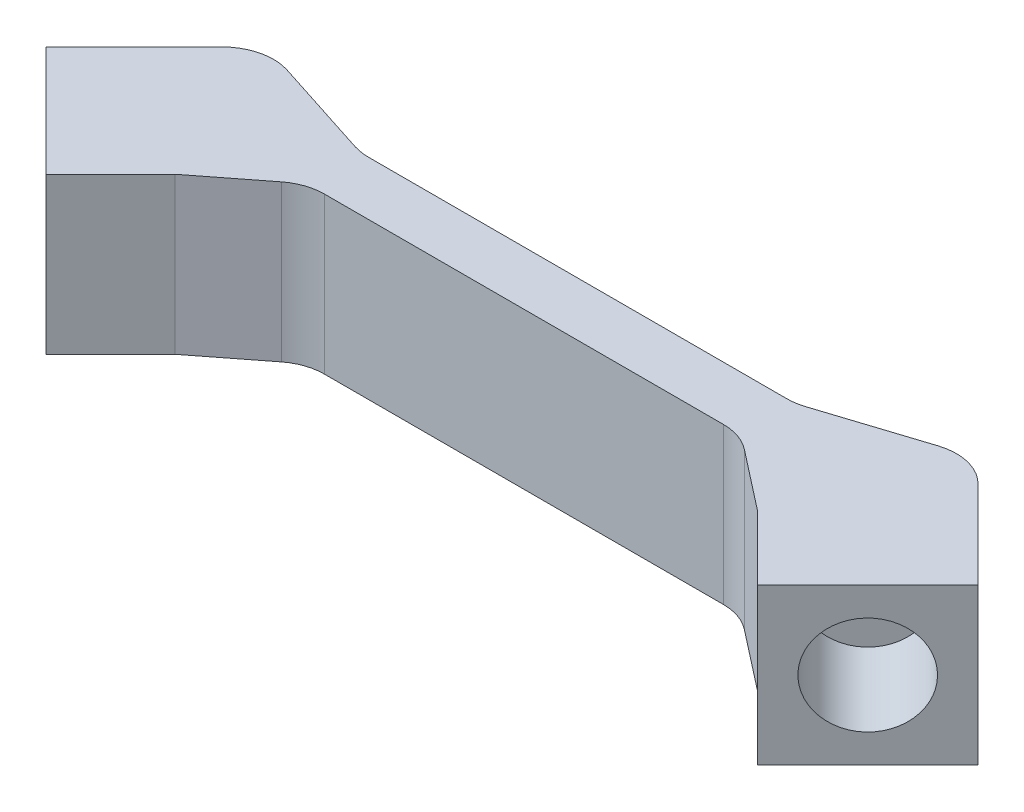
from build123d import *

# Parameters (mm, degrees)
BOSS_EXTRUDE1_DEPTH = 38.1
SKETCH2_R           = 12.065
CUT_EXTRUDE1_DEPTH  = 25.4
SKETCH7_R           = 12.065
CUT_EXTRUDE2_DEPTH  = 25.4
SKETCH9_W           = 26.289
SKETCH9_H           = 26.289
BOSS_EXTRUDE3_DEPTH = 8.89
SKETCH10_R          = 8.0645
CUT_EXTRUDE3_DEPTH  = 6.35
SKETCH12_R          = 6.35
CUT_EXTRUDE5_DEPTH  = 5.08
FILLET1_R           = 12.7


with BuildPart() as part:
    # Sketch1 → Boss-Extrude1 (new body)
    with BuildSketch(Plane(origin=(0, 0, 0), x_dir=(1, 0, 0), z_dir=(0, 1, 0))):
        with BuildLine():
            Line((-8.394951703, 35.720764917), (16.107614613, 27.828435078))
            ThreePointArc((16.107614613, 27.828435078), (18.03059142, 27.370657964), (20.001310729, 27.216823331))
            Line((20.001310729, 27.216823331), (122.238689271, 27.216823331))
            ThreePointArc((122.238689271, 27.216823331), (124.20940858, 27.370657964), (126.132385387, 27.828435078))
            Line((126.132385387, 27.828435078), (150.634951703, 35.720764917))
            ThreePointArc((150.634951703, 35.720764917), (157.509150211, 35.977683688), (163.508903941, 32.612632786))
            Line((163.508903941, 32.612632786), (184.96230509, 11.159231637))
            Line((184.96230509, 11.159231637), (158.021536726, -15.781536726))
            Line((158.021536726, -15.781536726), (142.24, 0))
            Line((142.24, 0), (127.676821583, 11.356327171))
            ThreePointArc((127.676821583, 11.356327171), (123.996342172, 13.351360126), (119.867179962, 14.041363479))
            Line((119.867179962, 14.041363479), (22.372820038, 14.041363479))
            ThreePointArc((22.372820038, 14.041363479), (18.243657828, 13.351360126), (14.563178417, 11.356327171))
            Line((14.563178417, 11.356327171), (0, 0))
            Line((0, 0), (-15.781536726, -15.781536726))
            Line((-15.781536726, -15.781536726), (-42.72230509, 11.159231637))
            Line((-42.72230509, 11.159231637), (-21.268903941, 32.612632786))
            ThreePointArc((-21.268903941, 32.612632786), (-15.269150211, 35.977683688), (-8.394951703, 35.720764917))
        make_face()
    extrude(amount=BOSS_EXTRUDE1_DEPTH)

    # Sketch2 → Cut-Extrude1 (cut)
    with BuildSketch(Plane(origin=(-15.781536726, 0, 15.781536726), x_dir=(0.7071067811865477, 0, 0.7071067811865475), z_dir=(-0.7071067811865475, 0, 0.7071067811865477))):
        with Locations((-19.05, 19.05)):
            Circle(SKETCH2_R)
    extrude(amount=-CUT_EXTRUDE1_DEPTH, mode=Mode.SUBTRACT)

    # Sketch7 → Cut-Extrude2 (cut)
    with BuildSketch(Plane(origin=(86.901536726, 0, 86.901536726), x_dir=(0.7071067811865472, 0, -0.7071067811865478), z_dir=(0.7071067811865478, 0, 0.7071067811865472))):
        with Locations((119.628868556, 19.05)):
            Circle(SKETCH7_R)
    extrude(amount=-CUT_EXTRUDE2_DEPTH, mode=Mode.SUBTRACT)

    # Sketch9 → Boss-Extrude3 (add)
    with BuildSketch(Plane(origin=(0, 0, -27.216823331), x_dir=(-1, 0, 0), z_dir=(0, 0, -1))):
        with Locations((-71.12, 13.1445)):
            Rectangle(SKETCH9_W, SKETCH9_H)
    extrude(amount=BOSS_EXTRUDE3_DEPTH)

    # Sketch10 → Cut-Extrude3 (cut)
    with BuildSketch(Plane(origin=(0, 0, -36.106823331), x_dir=(-1, 0, 0), z_dir=(0, 0, -1))):
        with Locations((-71.12, 13.1445)):
            Circle(SKETCH10_R)
    extrude(amount=-CUT_EXTRUDE3_DEPTH, mode=Mode.SUBTRACT)

    # Sketch12 → Cut-Extrude5 (cut)
    with BuildSketch(Plane(origin=(0, 0, -29.756823331), x_dir=(-1, 0, 0), z_dir=(0, 0, -1))):
        with Locations((-71.12, 13.1445)):
            Circle(SKETCH12_R)
    extrude(amount=-CUT_EXTRUDE5_DEPTH, mode=Mode.SUBTRACT)

    # Fillet1
    fillet1_edges = [part.edges().sort_by_distance(p)[0] for p in [
        (57.9755, 26.289, -31.661823331),
        (84.2645, 26.289, -31.661823331),
    ]]
    fillet(fillet1_edges, radius=FILLET1_R)


solid = part.part
